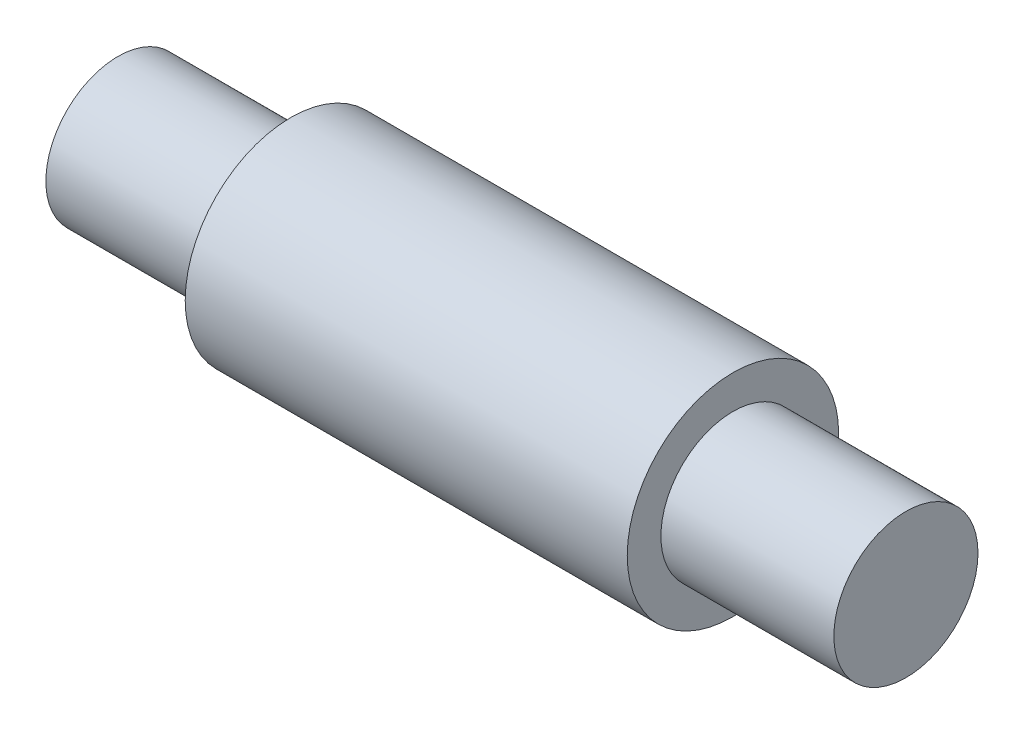
from build123d import *

# Parameters (mm, degrees)
ESBO_O2_R                = 7.5
RESSALTO_EXTRUS_O3_DEPTH = 41
ESBO_O2_5_R              = 11
ESBO_O2_5_R_2            = 7.5
RESSALTO_EXTRUS_O4_DEPTH = 23


with BuildPart() as part:
    # Esboço2 → Ressalto-extrusão3 (new, symmetric)
    with BuildSketch(Plane(origin=(0, 0, 0), x_dir=(0, 0, -1), z_dir=(1, 0, 0))):
        Circle(ESBO_O2_R)
    extrude(amount=RESSALTO_EXTRUS_O3_DEPTH, both=True)

    # Esboço2<5> → Ressalto-extrusão4 (add, symmetric)
    with BuildSketch(Plane(origin=(0, 0, 0), x_dir=(0, 0, -1), z_dir=(1, 0, 0))):
        Circle(ESBO_O2_5_R)
        Circle(ESBO_O2_5_R_2, mode=Mode.SUBTRACT)
    extrude(amount=RESSALTO_EXTRUS_O4_DEPTH, both=True)


solid = part.part
